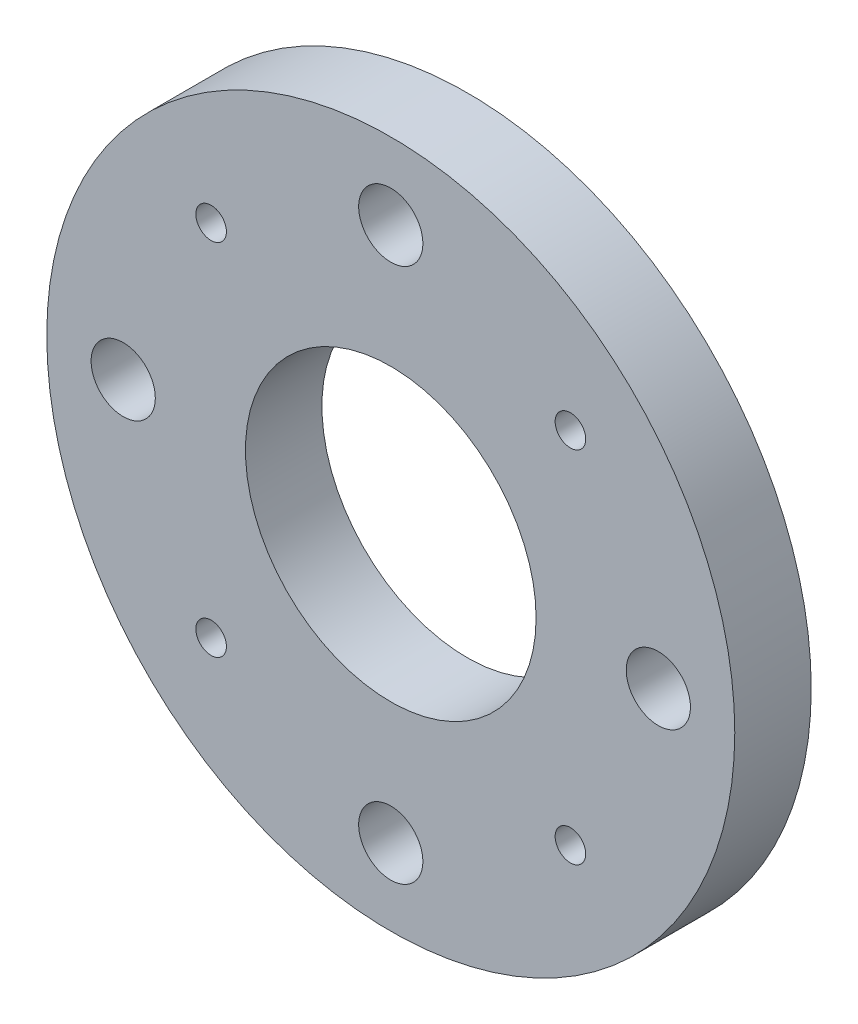
from build123d import *

# Parameters (mm, degrees)
SKETCH_1_R                   = 45
SKETCH_1_R_2                 = 19.01
EXTRUDE_1_DEPTH              = 10
HOLE_WIZARD_M4_1_D           = 3.3
HOLE_WIZARD_M4_1_DEPTH       = 10.1
HOLE_WIZARD_M4_1_CBORE_D     = 4
HOLE_WIZARD_M4_1_CBORE_DEPTH = 8
HOLE_WIZARD_M4_1_TIP         = 0.991420021
SKETCH_4_R                   = 4.2
CUT_EXTRUDE_1_DEPTH          = 10


with BuildPart() as part:
    # 草图1 → 拉伸1 (new body)
    with BuildSketch(Plane.XY):
        Circle(SKETCH_1_R)
        Circle(SKETCH_1_R_2, mode=Mode.SUBTRACT)
    extrude(amount=EXTRUDE_1_DEPTH)

    # M4 螺纹孔1
    with Locations(Plane(origin=(-23.5, 23.5, 10), x_dir=(1, 0, 0), z_dir=(0, 0, 1))):
        with Locations((0, 0), (47, 0), (47, -47), (0, -47)):
            CounterBoreHole(HOLE_WIZARD_M4_1_D / 2, HOLE_WIZARD_M4_1_CBORE_D / 2, HOLE_WIZARD_M4_1_CBORE_DEPTH, depth=HOLE_WIZARD_M4_1_DEPTH)
            with Locations((0, 0, -(HOLE_WIZARD_M4_1_DEPTH + HOLE_WIZARD_M4_1_TIP / 2))):  # 118° drill point
                Cone(0, HOLE_WIZARD_M4_1_D / 2, HOLE_WIZARD_M4_1_TIP, mode=Mode.SUBTRACT)

    # 草图4 → 切除-拉伸1 (cut)
    with BuildSketch(Plane.XY.offset(10)):
        with Locations((0, 35)):
            Circle(SKETCH_4_R)
        with Locations((-35, 0)):
            Circle(SKETCH_4_R)
        with Locations((0, -35)):
            Circle(SKETCH_4_R)
        with Locations((35, 0)):
            Circle(SKETCH_4_R)
    extrude(amount=-CUT_EXTRUDE_1_DEPTH, mode=Mode.SUBTRACT)


solid = part.part
